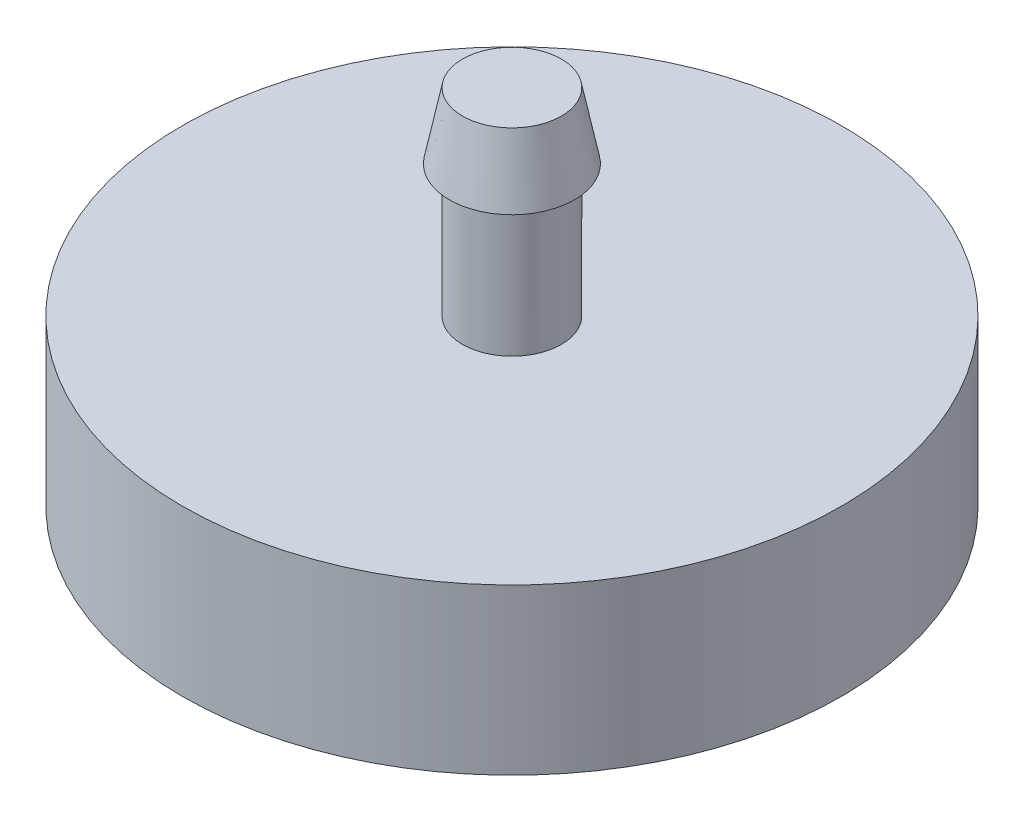
from build123d import *

# Parameters (mm, degrees)
SKETCH1_R           = 5
BOSS_EXTRUDE1_DEPTH = 2.5
SKETCH2_R           = 0.75
BOSS_EXTRUDE2_DEPTH = 3


with BuildPart() as part:
    # Sketch1 → Boss-Extrude1 (new body)
    with BuildSketch(Plane(origin=(0, 0, 0), x_dir=(1, 0, 0), z_dir=(0, 1, 0))):
        with Locations(Location((0, 0, 0), (0, 0, 270))):
            Circle(SKETCH1_R)
    extrude(amount=BOSS_EXTRUDE1_DEPTH)

    # Sketch2 → Boss-Extrude2 (add)
    with BuildSketch(Plane(origin=(0, 2.5, 0), x_dir=(1, 0, 0), z_dir=(0, 1, 0))):
        with Locations(Location((0, 0, 0), (0, 0, 270))):
            Circle(SKETCH2_R)
    extrude(amount=BOSS_EXTRUDE2_DEPTH)

    # Sketch3 → Revolve1 (revolve)
    with BuildSketch(Plane.XY, mode=Mode.PRIVATE) as revolve1_sk:
        Polygon((0.75, 5.5), (0.75, 4.5), (0.95, 4.5), align=None)
    revolve(revolve1_sk.sketch.rotate(Axis((0, 0, 0), (0, 1, 0)), 90), axis=Axis((0, 0, 0), (0, 1, 0)))


solid = part.part
